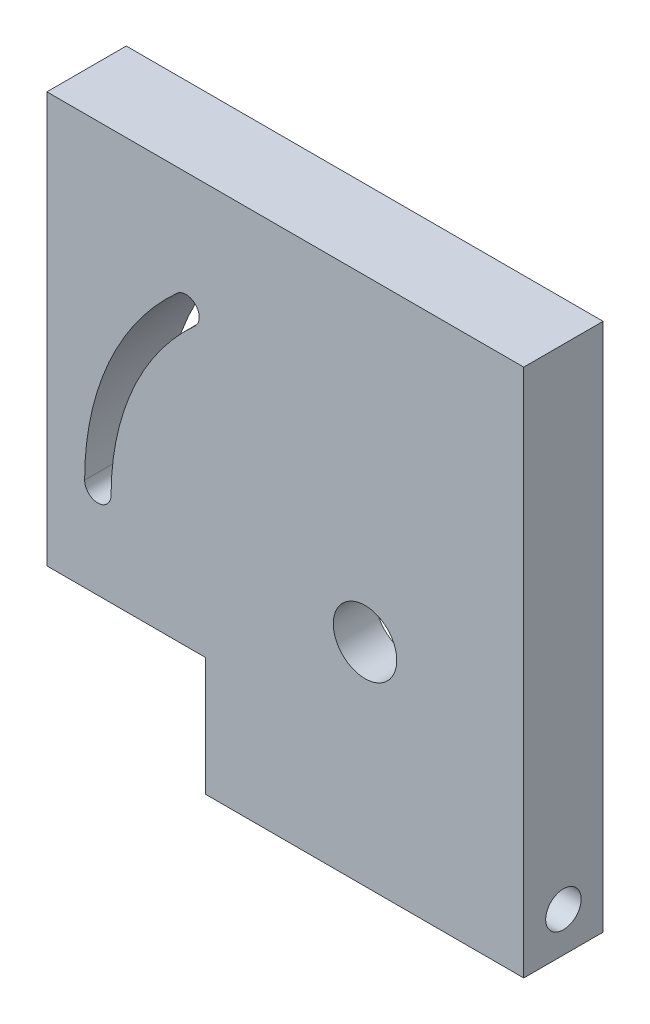
from build123d import *

# Parameters (mm, degrees)
SKETCH_1_W                   = 90.133378614
SKETCH_1_H                   = 100
EXTRUDE_1_DEPTH              = 15
HOLE_WIZARD_M101_D           = 12
HOLE_WIZARD_M101_CBORE_D     = 35
HOLE_WIZARD_M101_CBORE_DEPTH = 7
SKETCH_10_W                  = 15
SKETCH_10_H                  = 22.389140256
CUT_EXTRUDE_3_DEPTH          = 30
SKETCH_12_R                  = 3.35
CUT_EXTRUDE_4_DEPTH          = 10
CUT_EXTRUDE_START            = -10
SKETCH_14_R                  = 3.35
CUT_EXTRUDE_5_DEPTH          = 10
CUT_EXTRUDE_6_DEPTH          = 87.261365764


with BuildPart() as part:
    # Эскиз1 → Бобышка-Вытянуть1 (new body)
    with BuildSketch(Plane.XY.offset(15)):
        with Locations((-15.066689307, 10)):
            Rectangle(SKETCH_1_W, SKETCH_1_H)
    extrude(amount=-EXTRUDE_1_DEPTH)

    # Цековка для  болта с шестигранной головкой M101 (through all)
    with Locations(Plane(origin=(0, 0, 0), x_dir=(-1, 0, 0), z_dir=(0, 0, -1))):
        with Locations((0, 0)):
            CounterBoreHole(HOLE_WIZARD_M101_D / 2, HOLE_WIZARD_M101_CBORE_D / 2, HOLE_WIZARD_M101_CBORE_DEPTH)

    # Эскиз10 → Вырез-Вытянуть3 (cut)
    with BuildSketch(Plane.ZY.offset(60.133378614)):
        with Locations((7.5, -28.805429872)):
            Rectangle(SKETCH_10_W, SKETCH_10_H)
    extrude(amount=-CUT_EXTRUDE_3_DEPTH, mode=Mode.SUBTRACT)

    # Эскиз12 → Вырез-Вытянуть4 (cut)
    with BuildSketch(Plane.ZY.offset(30.133378614)):
        with Locations(Location((7.5, -32.5, 0), (0, 0, 270))):
            Circle(SKETCH_12_R)
    extrude(amount=-CUT_EXTRUDE_4_DEPTH, mode=Mode.SUBTRACT)

    # Эскиз14 → Вырез-Вытянуть5 (cut)
    with BuildSketch(Plane(origin=(30, 0, 0), x_dir=(0, 0, -1), z_dir=(1, 0, 0)).offset(CUT_EXTRUDE_START)):
        with Locations(Location((-7.5, -32.5, 0), (0, 0, 270))):
            Circle(SKETCH_14_R)
    extrude(amount=CUT_EXTRUDE_5_DEPTH, mode=Mode.SUBTRACT)

    # Эскиз18 → Вырез-Вытянуть6 (cut, through all)
    with BuildSketch(Plane.XY.offset(15)):
        with BuildLine():
            ThreePointArc((-35.524835884, 39.336218188), (-48.437001879, 21.522287864), (-53.003320895, 0))
            ThreePointArc((-53.003320895, 0), (-50.503320895, -2.5), (-48.003320895, 0))
            ThreePointArc((-48.003320895, 0), (-43.867759701, 19.492010563), (-32.173646253, 35.625486717))
            ThreePointArc((-32.173646253, 35.625486717), (-31.993875333, 39.156447268), (-35.524835884, 39.336218188))
        make_face()
    extrude(amount=-CUT_EXTRUDE_6_DEPTH, mode=Mode.SUBTRACT)


solid = part.part
